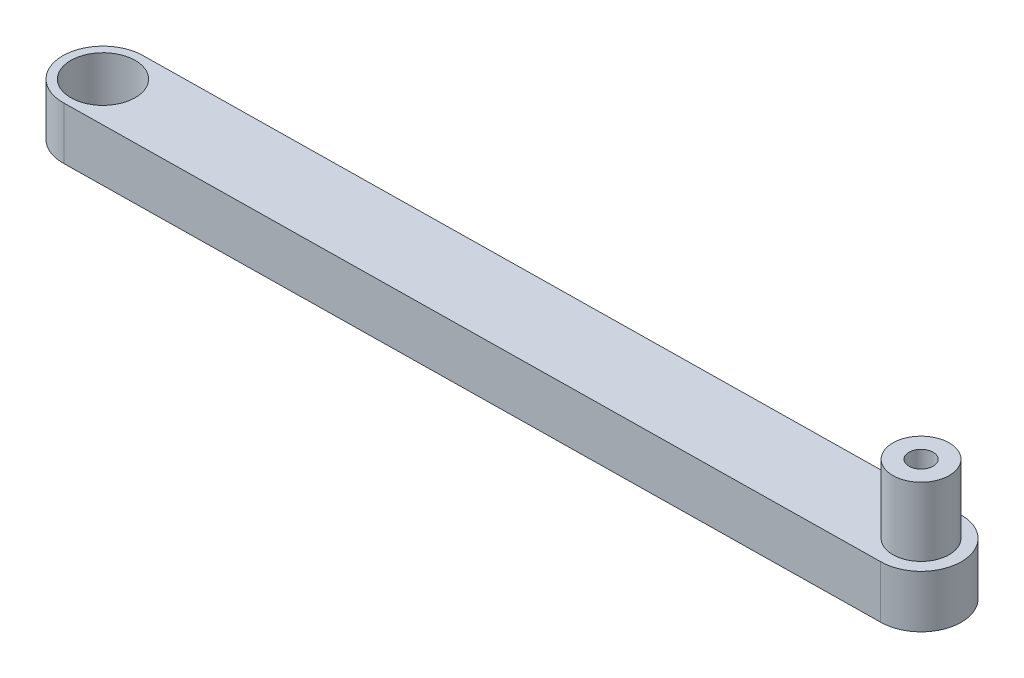
from build123d import *

# Parameters (mm, degrees)
SKETCH_1_R          = 4
EXTRUDE_1_DEPTH     = 6.5
SKETCH_2_R          = 3.5
EXTRUDE_2_DEPTH     = 8.5
SKETCH_3_R          = 1.5
CUT_EXTRUDE_1_DEPTH = 107.248752968


with BuildPart() as part:
    # 草图1 → 凸台-拉伸1 (new body)
    with BuildSketch(Plane(origin=(0, 0, 0), x_dir=(1, 0, 0), z_dir=(0, 1, 0))):
        with BuildLine():
            ThreePointArc((0, 5), (-4.999517366, -0.06947017), (0.138926929, -4.998069558))
            Line((0.138926929, -4.998069558), (99.990347325, -3.61059659))
            ThreePointArc((99.990347325, -3.61059659), (104.990347325, 1.38940341), (99.990347325, 6.38940341))
            Line((99.990347325, 6.38940341), (0, 5))
        make_face()
        with Locations(Location((0, 0, 0), (0, 0, 90))):
            Circle(SKETCH_1_R, mode=Mode.SUBTRACT)
    extrude(amount=EXTRUDE_1_DEPTH)

    # 草图2 → 凸台-拉伸2 (add)
    with BuildSketch(Plane(origin=(0, 6.5, 0), x_dir=(1, 0, 0), z_dir=(0, 1, 0))):
        with Locations(Location((99.990347325, 1.38940341, 0), (0, 0, 270))):
            Circle(SKETCH_2_R)
    extrude(amount=EXTRUDE_2_DEPTH)

    # 草图3 → 切除-拉伸1 (cut, through all)
    with BuildSketch(Plane(origin=(0, 15, 0), x_dir=(1, 0, 0), z_dir=(0, 1, 0))):
        with Locations(Location((99.990347325, 1.38940341, 0), (0, 0, 270))):
            Circle(SKETCH_3_R)
    extrude(amount=-CUT_EXTRUDE_1_DEPTH, mode=Mode.SUBTRACT)


solid = part.part
